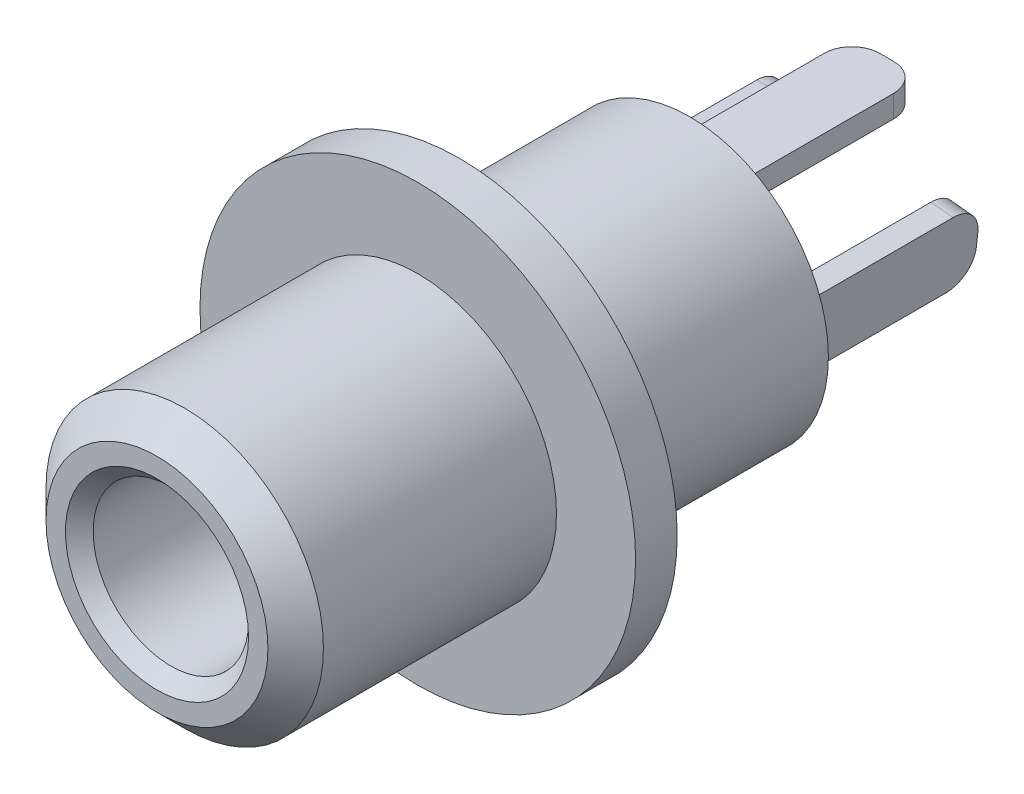
from build123d import *

# Parameters (mm, degrees)
SKETCH1_R           = 5
BOSS_EXTRUDE1_DEPTH = 9.8
SKETCH2_R           = 7.85
BOSS_EXTRUDE2_DEPTH = 1.5
SKETCH3_R           = 5
BOSS_EXTRUDE3_DEPTH = 9.4
SKETCH4_W           = 2.5
SKETCH4_H           = 0.8
SKETCH4_W_2         = 0.8
SKETCH4_H_2         = 2.5
BOSS_EXTRUDE4_DEPTH = 7.1
FILLET1_R           = 1
SKETCH6_R           = 2.8
CUT_EXTRUDE1_DEPTH  = 15
SKETCH7_R           = 1.25
BOSS_EXTRUDE5_DEPTH = 8
CHAMFER1_SIZE       = 1
CHAMFER2_SIZE       = 0.5


with BuildPart() as part:
    # Sketch1 → Boss-Extrude1 (new body)
    with BuildSketch(Plane.XY):
        Circle(SKETCH1_R)
    extrude(amount=BOSS_EXTRUDE1_DEPTH)

    # Sketch2 → Boss-Extrude2 (add)
    with BuildSketch(Plane.XY.offset(9.8)):
        Circle(SKETCH2_R)
    extrude(amount=-BOSS_EXTRUDE2_DEPTH)

    # Sketch3 → Boss-Extrude3 (add)
    with BuildSketch(Plane.XY.offset(9.8)):
        Circle(SKETCH3_R)
    extrude(amount=BOSS_EXTRUDE3_DEPTH)

    # Sketch4 → Boss-Extrude4 (add)
    with BuildSketch(Plane(origin=(0, 0, 0), x_dir=(-1, 0, 0), z_dir=(0, 0, -1))):
        with Locations((0, 2.9)):
            Rectangle(SKETCH4_W, SKETCH4_H)
        with Locations((3.285473872, 0)):
            Rectangle(SKETCH4_W_2, SKETCH4_H_2)
        Polygon((-3.130059347, -1.992660833), (-3.391380505, 0.493643905), (-2.595762989, 0.577266676), (-2.33444183, -1.909038062), align=None)
    extrude(amount=BOSS_EXTRUDE4_DEPTH)

    # Fillet1
    fillet1_edges = [part.edges().sort_by_distance(p)[0] for p in [
        (1.25, 2.9, -7.1),
        (-1.25, 2.9, -7.1),
        (-3.285473872, 1.25, -7.1),
        (-3.285473872, -1.25, -7.1),
        (2.732250589, -1.950849448, -7.1),
        (2.993571747, 0.535455291, -7.1),
    ]]
    fillet(fillet1_edges, radius=FILLET1_R)

    # Sketch6 → Cut-Extrude1 (cut)
    with BuildSketch(Plane.XY.offset(19.2)):
        Circle(SKETCH6_R)
    extrude(amount=-CUT_EXTRUDE1_DEPTH, mode=Mode.SUBTRACT)

    # Sketch7 → Boss-Extrude5 (add)
    with BuildSketch(Plane.XY.offset(4.2)):
        Circle(SKETCH7_R)
    extrude(amount=BOSS_EXTRUDE5_DEPTH)

    # Chamfer1
    chamfer1_edges = [part.edges().sort_by_distance(p)[0] for p in [
        (-5, 0, 19.2),
    ]]
    chamfer(chamfer1_edges, length=CHAMFER1_SIZE)

    # Chamfer2
    chamfer2_edges = [part.edges().sort_by_distance(p)[0] for p in [
        (-2.8, 0, 19.2),
    ]]
    chamfer(chamfer2_edges, length=CHAMFER2_SIZE)


solid = part.part
